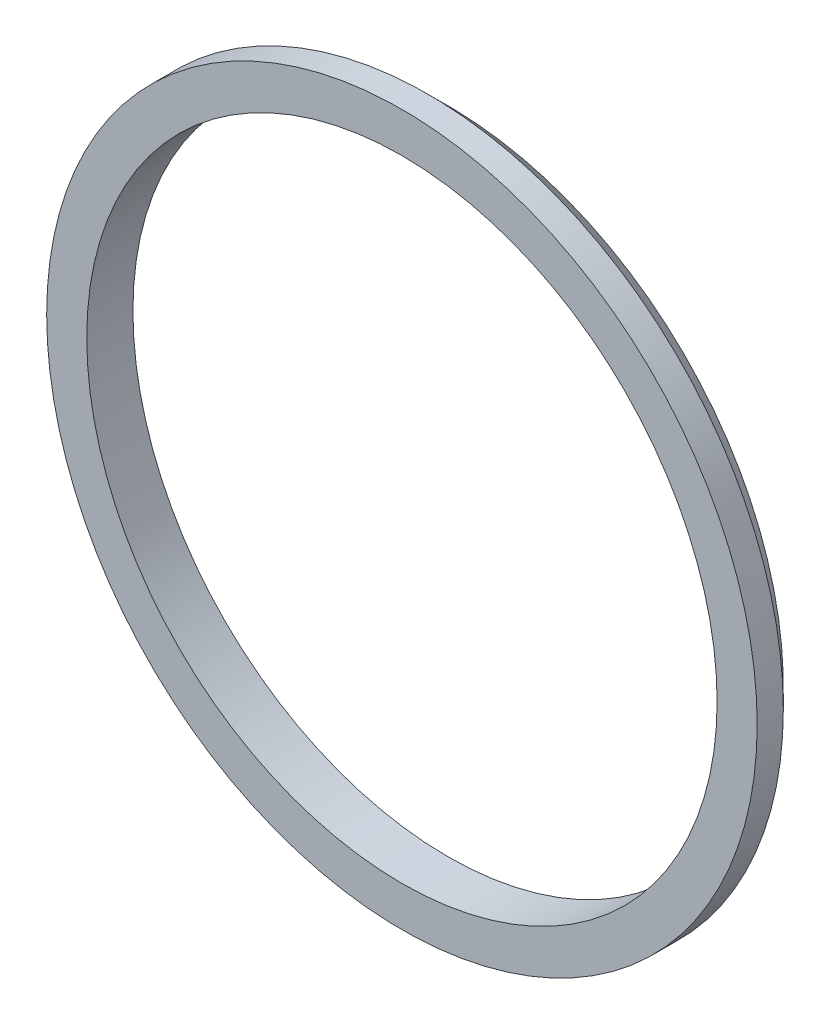
from build123d import *


with BuildPart() as part:
    # Sketch4 → Revolve1 (revolve)
    with BuildSketch(Plane(origin=(0, 0, 0), x_dir=(1, 0, 0), z_dir=(0, 1, 0)), mode=Mode.PRIVATE) as revolve1_sk:
        Polygon((100.366025404, 0), (94.366025404, 0), (94.366025404, -13.825), (100.366025404, -13.825), (106.366025404, -13.825), (106.366025404, -6), align=None)
    revolve(revolve1_sk.sketch.rotate(Axis((0, 0, 0), (0, 0, 1)), 180), axis=Axis((0, 0, 0), (0, 0, 1)))


solid = part.part
